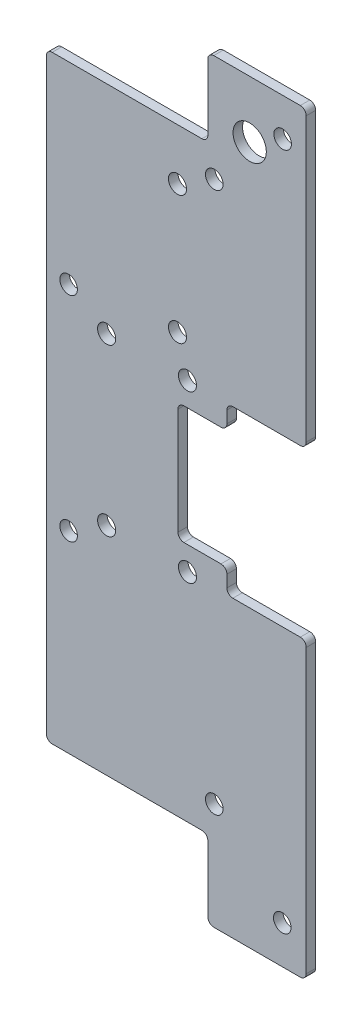
from build123d import *

# Parameters (mm, degrees)
SKETCH1_R               = 2.3495
SKETCH1_R_2             = 4.445
BOSS_EXTRUDE1_DEPTH     = 2.54
SKETCH2_R               = 2.413
CUT_EXTRUDE1_DEPTH      = 217.884748371
SKETCH3_W               = 13.08488816
SKETCH3_H               = 31.623
CUT_EXTRUDE2_DEPTH      = 217.884748371
SKETCH4_W               = 12.77569874
SKETCH4_H               = 24.435209008
SKETCH4_W_2             = 40.233428475
SKETCH4_H_2             = 28.333759116
CUT_EXTRUDE3_DEPTH      = 217.884748371
SKETCH5_R               = 2.413
CUT_EXTRUDE4_DEPTH      = 217.884748371
CUT_EXTRUDE5_DEPTH      = 217.884748371
CUT_EXTRUDE5_DEPTH_BACK = 217.884748371
SKETCH8_R               = 2.3495
CUT_EXTRUDE6_DEPTH      = 191.226610272
FILLET1_R               = 1.5875
SKETCH9_W               = 0.38488816
SKETCH9_H               = 2.54
CUT_EXTRUDE7_DEPTH      = 152.146866512


with BuildPart() as part:
    # Sketch1 → Boss-Extrude1 (new body)
    with BuildSketch(Plane.XY):
        Polygon((-2.930050059, -104.509781075), (-3.314938219, -104.509781075), (-3.314938219, -110.859781075), (-3.314938219, -123.559781075), (-2.930050059, -123.559781075), (-2.930050059, -168.708281075), (38.709428475, -168.708281075), (38.709428475, -189.536281075), (105.397061781, -189.536281075), (66.517436481, -110.859781075), (45.329949941, -110.859781075), (45.329949941, -104.509781075), (45.329949941, -72.886781075), (45.329949941, -66.536781075), (66.517436481, -66.536781075), (105.397061781, 12.139718925), (38.709428475, 12.139718925), (38.709428475, -8.688281075), (-2.930050059, -8.688281075), (-2.930050059, -53.836781075), (-3.314938219, -53.836781075), (-3.314938219, -66.536781075), (-3.314938219, -72.886781075), (-2.930050059, -72.886781075), align=None)
        with Locations((90.673911143, 2.614718925)):
            Circle(SKETCH1_R, mode=Mode.SUBTRACT)
        with Locations((41.95655448, -16.435281075)):
            Circle(SKETCH1_R, mode=Mode.SUBTRACT)
        with Locations((3.035061781, -60.186781075)):
            Circle(SKETCH1_R, mode=Mode.SUBTRACT)
        with Locations((3.035061781, -117.209781075)):
            Circle(SKETCH1_R, mode=Mode.SUBTRACT)
        with Locations((41.95655448, -160.961281075)):
            Circle(SKETCH1_R, mode=Mode.SUBTRACT)
        with Locations((90.673911143, -180.011281075)):
            Circle(SKETCH1_R, mode=Mode.SUBTRACT)
        with Locations((51.409428475, -3.100281075)):
            Circle(SKETCH1_R_2, mode=Mode.SUBTRACT)
    extrude(amount=BOSS_EXTRUDE1_DEPTH)

    # Sketch2 → Cut-Extrude1 (cut, through all)
    with BuildSketch(Plane.XY.offset(2.54)):
        with Locations((13.195061781, -66.536781075)):
            Circle(SKETCH2_R)
        with Locations((34.785061781, -66.536781075)):
            Circle(SKETCH2_R)
        with Locations(Location((34.785061781, -110.859781075, 0), (0, 0, 180))):
            Circle(SKETCH2_R)
        with Locations(Location((13.195061781, -110.859781075, 0), (0, 0, 180))):
            Circle(SKETCH2_R)
    extrude(amount=-CUT_EXTRUDE1_DEPTH, mode=Mode.SUBTRACT)

    # Sketch3 → Cut-Extrude2 (cut, through all)
    with BuildSketch(Plane.XY.offset(2.54)):
        with Locations((38.787505861, -88.698281075)):
            Rectangle(SKETCH3_W, SKETCH3_H)
    extrude(amount=-CUT_EXTRUDE2_DEPTH, mode=Mode.SUBTRACT)

    # Sketch4 → Cut-Extrude3 (cut, through all)
    with BuildSketch(Plane.XY.offset(2.54)):
        with Locations((33.845579105, 3.529323429)):
            Rectangle(SKETCH4_W, SKETCH4_H)
        with Locations((20.116714238, -182.875160633)):
            Rectangle(SKETCH4_W_2, SKETCH4_H_2)
    extrude(amount=-CUT_EXTRUDE3_DEPTH, mode=Mode.SUBTRACT)

    # Sketch5 → Cut-Extrude4 (cut, through all)
    with BuildSketch(Plane(origin=(0, 0, 0), x_dir=(-1, 0, 0), z_dir=(0, 0, -1))):
        with Locations((-32.121949941, -22.404281075)):
            Circle(SKETCH5_R)
        with Locations((-32.121949941, -56.694281075)):
            Circle(SKETCH5_R)
    extrude(amount=-CUT_EXTRUDE4_DEPTH, mode=Mode.SUBTRACT)

    # Sketch7 → Cut-Extrude5 (cut, two sides: drawn at the far end of the back side and taken through both)
    with BuildSketch(Plane.XY.offset(2.54).offset(-CUT_EXTRUDE5_DEPTH_BACK)):
        Polygon((66.517436481, -66.536781075), (66.517436481, 21.52212206), (127.820808625, 21.52212206), (115.78217236, -200.256310461), (66.517436481, -200.256310461), (66.517436481, -110.859781075), align=None)
    extrude(amount=CUT_EXTRUDE5_DEPTH + CUT_EXTRUDE5_DEPTH_BACK, mode=Mode.SUBTRACT)

    # Sketch8 → Cut-Extrude6 (cut, through all)
    with BuildSketch(Plane(origin=(13.551580143, -170.546705634, 0), x_dir=(0.9999106684671756, -0.013366191885727564, 0), z_dir=(0, 0, -1))):
        with Locations(Location((44.353535624, -173.175566882, 0), (0, 0, 179.234150812))):
            Circle(SKETCH8_R)
        with Locations(Location((46.68181957, 8.1642617, 0), (0, 0, 179.234150812))):
            Circle(SKETCH8_R)
    extrude(amount=-CUT_EXTRUDE6_DEPTH, mode=Mode.SUBTRACT)

    # Fillet1
    fillet1_edges = [part.edges().sort_by_distance(p)[0] for p in [
        (45.329949941, -72.886781075, 1.27),
        (45.329949941, -104.509781075, 1.27),
        (32.245061781, -104.509781075, 1.27),
        (32.245061781, -72.886781075, 1.27),
        (40.233428475, -189.536281075, 1.27),
        (40.233428475, 12.139718925, 1.27),
        (40.233428475, -8.688281075, 1.27),
        (40.233428475, -168.708281075, 1.27),
        (66.517436481, 12.139718925, 1.27),
        (66.517436481, -189.536281075, 1.27),
        (45.329949941, -66.536781075, 1.27),
        (45.329949941, -110.859781075, 1.27),
        (66.517436481, -110.859781075, 1.27),
        (-2.930050059, -168.708281075, 1.27),
        (-2.930050059, -8.688281075, 1.27),
        (66.517436481, -66.536781075, 1.27),
    ]]
    fillet(fillet1_edges, radius=FILLET1_R)

    # Sketch9 → Cut-Extrude7 (cut, through all)
    with BuildSketch(Plane.XZ.offset(123.559781075)):
        with Locations((-3.122494139, 1.27)):
            Rectangle(SKETCH9_W, SKETCH9_H)
    extrude(amount=-CUT_EXTRUDE7_DEPTH, mode=Mode.SUBTRACT)


solid = part.part
